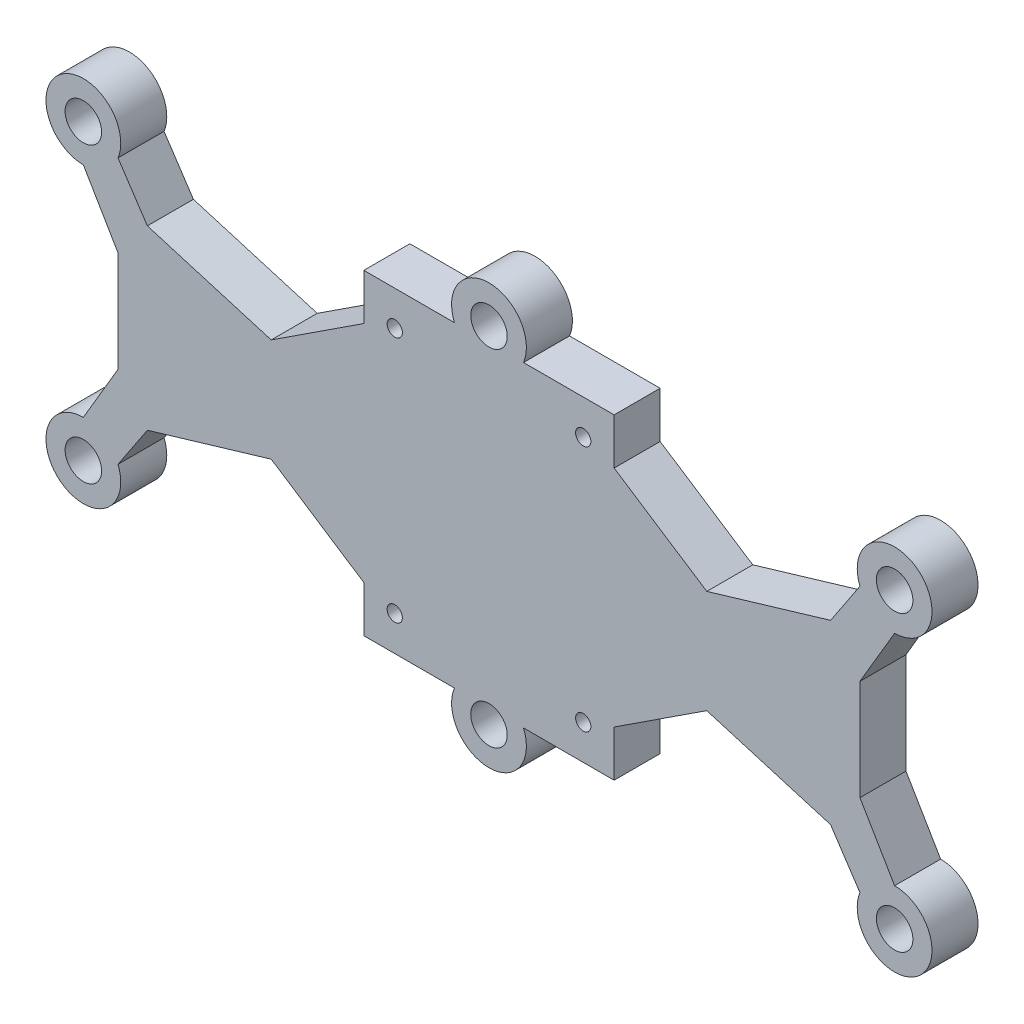
from build123d import *

# Parameters (mm, degrees)
SKETCH1_R           = 3.175
SKETCH1_R_2         = 1.325
BOSS_EXTRUDE1_DEPTH = 8


with BuildPart() as part:
    # Sketch1 → Boss-Extrude1 (new body)
    with BuildSketch(Plane.XY):
        with BuildLine():
            Line((-21.75, 27.5), (-6, 27.5))
            ThreePointArc((-6, 27.5), (0, 36.5), (6, 27.5))
            Line((6, 27.5), (21.75, 27.5))
            Line((21.75, 27.5), (21.75, 19.489664619))
            Line((21.75, 19.489664619), (37.852514493, 8.977148354))
            Line((37.852514493, 8.977148354), (59.375273358, 15.378390657))
            Line((59.375273358, 15.378390657), (64.476863532, 23.056267795))
            ThreePointArc((64.476863532, 23.056267795), (74.130822267, 30.891394037), (70.5, 19))
            Line((70.5, 19), (64.476863532, 8.759983115))
            Line((64.476863532, 8.759983115), (64.476863532, -8.759983115))
            Line((64.476863532, -8.759983115), (70.5, -19))
            ThreePointArc((70.5, -19), (74.130822267, -30.891394037), (64.476863532, -23.056267795))
            Line((64.476863532, -23.056267795), (59.375273358, -15.378390657))
            Line((59.375273358, -15.378390657), (37.852514493, -8.977148354))
            Line((37.852514493, -8.977148354), (21.75, -19.489664619))
            Line((21.75, -19.489664619), (21.75, -27.5))
            Line((21.75, -27.5), (6, -27.5))
            ThreePointArc((6, -27.5), (0, -36.5), (-6, -27.5))
            Line((-6, -27.5), (-21.75, -27.5))
            Line((-21.75, -27.5), (-21.75, -19.489664619))
            Line((-21.75, -19.489664619), (-37.852514493, -8.977148354))
            Line((-37.852514493, -8.977148354), (-59.375273358, -15.378390657))
            Line((-59.375273358, -15.378390657), (-64.476863532, -23.056267795))
            ThreePointArc((-64.476863532, -23.056267795), (-74.130822267, -30.891394037), (-70.5, -19))
            Line((-70.5, -19), (-64.476863532, -8.759983115))
            Line((-64.476863532, -8.759983115), (-64.476863532, 8.759983115))
            Line((-64.476863532, 8.759983115), (-70.5, 19))
            ThreePointArc((-70.5, 19), (-74.130822267, 30.891394037), (-64.476863532, 23.056267795))
            Line((-64.476863532, 23.056267795), (-59.375273358, 15.378390657))
            Line((-59.375273358, 15.378390657), (-37.852514493, 8.977148354))
            Line((-37.852514493, 8.977148354), (-21.75, 19.489664619))
            Line((-21.75, 19.489664619), (-21.75, 27.5))
        make_face()
        with Locations((0, 30)):
            Circle(SKETCH1_R, mode=Mode.SUBTRACT)
        with Locations((70.5, 25.5)):
            Circle(SKETCH1_R, mode=Mode.SUBTRACT)
        with Locations(Location((70.5, -25.5, 0), (0, 0, 180))):
            Circle(SKETCH1_R, mode=Mode.SUBTRACT)
        with Locations(Location((0, -30, 0), (0, 0, 180))):
            Circle(SKETCH1_R, mode=Mode.SUBTRACT)
        with Locations((-70.5, -25.5)):
            Circle(SKETCH1_R, mode=Mode.SUBTRACT)
        with Locations(Location((-70.5, 25.5, 0), (0, 0, 180))):
            Circle(SKETCH1_R, mode=Mode.SUBTRACT)
        with Locations((16.38, 21.46)):
            Circle(SKETCH1_R_2, mode=Mode.SUBTRACT)
        with Locations(Location((-16.38, 21.46, 0), (0, 0, 180))):
            Circle(SKETCH1_R_2, mode=Mode.SUBTRACT)
        with Locations((-16.38, -21.46)):
            Circle(SKETCH1_R_2, mode=Mode.SUBTRACT)
        with Locations(Location((16.38, -21.46, 0), (0, 0, 180))):
            Circle(SKETCH1_R_2, mode=Mode.SUBTRACT)
    extrude(amount=BOSS_EXTRUDE1_DEPTH)


solid = part.part
